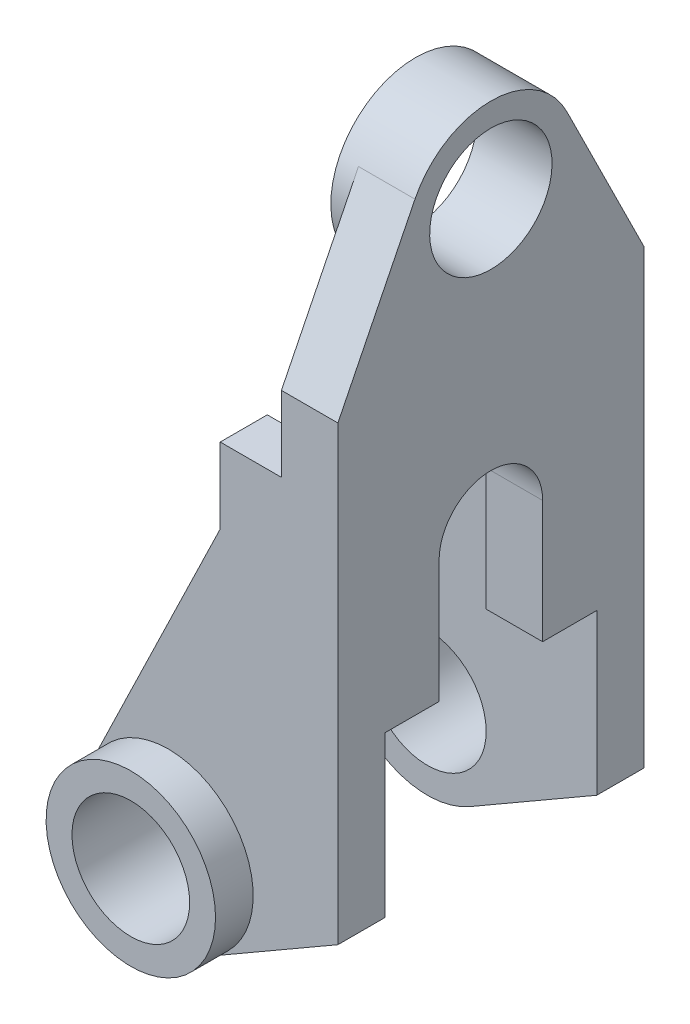
from build123d import *

# Parameters (mm, degrees)
BOSS_EXTRUDE1_DEPTH = 5
BOSS_EXTRUDE2_START = 8
SKETCH2_R           = 12.5
BOSS_EXTRUDE2_DEPTH = 8
CUT_EXTRUDE1_REACH  = 91.615
SKETCH3_R           = 12.5
SKETCH5_R           = 13
BOSS_EXTRUDE3_DEPTH = 12
SKETCH6_R           = 18
SKETCH6_R_2         = 13
BOSS_EXTRUDE4_DEPTH = 16
CUT_EXTRUDE2_REACH  = 160.918
SKETCH7_R           = 12.5
BOSS_EXTRUDE5_DEPTH = 12


with BuildPart() as part:
    # Sketch1 → Boss-Extrude1 (new, symmetric)
    with BuildSketch(Plane.XY):
        with BuildLine():
            Line((27.199616854, 56.153190853), (27.199616854, 72.153190853))
            Line((27.199616854, 72.153190853), (52.199616854, 72.153190853))
            Line((52.199616854, 72.153190853), (52.199616854, -7.846809147))
            Line((52.199616854, -7.846809147), (25.199616854, -23.435266415))
            ThreePointArc((25.199616854, -23.435266415), (3.94149511, -21.027797399), (0, 0))
            Line((0, 0), (27.199616854, 56.153190853))
        make_face()
    boss_extrude1 = extrude(amount=BOSS_EXTRUDE1_DEPTH, both=True)

    # Sketch2 → Boss-Extrude2 (add)
    with BuildSketch(Plane.XY.offset(5).offset(BOSS_EXTRUDE2_START)):
        with BuildLine():
            ThreePointArc((34.199616854, -7.846809147), (20.224967561, 9.697322399), (0, 0))
            ThreePointArc((0, 0), (3.94149511, -21.027797399), (25.199616854, -23.435266415))
            ThreePointArc((25.199616854, -23.435266415), (31.788074122, -16.846809147), (34.199616854, -7.846809147))
        make_face()
        with Locations((16.199616854, -7.846809147)):
            Circle(SKETCH2_R, mode=Mode.SUBTRACT)
    boss_extrude2 = extrude(amount=-BOSS_EXTRUDE2_DEPTH)

    # Sketch3 → Cut-Extrude1 (cut, up to next)
    with BuildSketch(Plane.XY.offset(5), mode=Mode.PRIVATE) as cut_extrude1_sk1:
        with Locations(Location((16.199616854, -7.846809147, 0), (0, 0, 180))):
            Circle(SKETCH3_R)
    cut_extrude1_tool1 = extrude(cut_extrude1_sk1.sketch, amount=-CUT_EXTRUDE1_REACH, mode=Mode.PRIVATE) & part.part
    add(cut_extrude1_tool1.solids().sort_by_distance((16.199617, -7.846809, 5))[0], mode=Mode.SUBTRACT)

    # Sketch5 → Boss-Extrude3 (add)
    with BuildSketch(Plane(origin=(52.199616854, 0, 0), x_dir=(0, 0, -1), z_dir=(1, 0, 0))):
        with BuildLine():
            Line((11.376048584, 121.154327694), (-5, 88.153190853))
            Line((-5, 88.153190853), (-5, 72.153190853))
            Line((-5, 72.153190853), (60, 72.153190853))
            Line((60, 72.153190853), (60, 88.153190853))
            Line((60, 88.153190853), (43.623951416, 121.154327694))
            ThreePointArc((43.623951416, 121.154327694), (27.5, 131.153190853), (11.376048584, 121.154327694))
        make_face()
        with Locations(Location((27.5, 113.153190853, 0), (0, 0, 90))):
            Circle(SKETCH5_R, mode=Mode.SUBTRACT)
    extrude(amount=-BOSS_EXTRUDE3_DEPTH)

    # Sketch6 → Boss-Extrude4 (add)
    with BuildSketch(Plane(origin=(52.199616854, 0, 0), x_dir=(0, 0, -1), z_dir=(1, 0, 0))):
        with Locations(Location((27.5, 113.153190853, 0), (0, 0, 90))):
            Circle(SKETCH6_R)
        with Locations(Location((27.5, 113.153190853, 0), (0, 0, 90))):
            Circle(SKETCH6_R_2, mode=Mode.SUBTRACT)
    extrude(amount=-BOSS_EXTRUDE4_DEPTH)

    # Mirror1: Boss-Extrude1, Boss-Extrude2 across plane
    add(boss_extrude1.mirror(Plane.XY.offset(-27.5)))
    add(boss_extrude2.mirror(Plane.XY.offset(-27.5)))

    # Sketch7 → Cut-Extrude2 (cut, up to next)
    with BuildSketch(Plane(origin=(0, 0, -60), x_dir=(-1, 0, 0), z_dir=(0, 0, -1)), mode=Mode.PRIVATE) as cut_extrude2_sk1:
        with Locations((-16.199616854, -7.846809147)):
            Circle(SKETCH7_R)
    cut_extrude2_tool1 = extrude(cut_extrude2_sk1.sketch, amount=-CUT_EXTRUDE2_REACH, mode=Mode.PRIVATE) & part.part
    add(cut_extrude2_tool1.solids().sort_by_distance((16.199617, -7.846809, -60))[0], mode=Mode.SUBTRACT)

    # Sketch8 → Boss-Extrude5 (add)
    with BuildSketch(Plane.ZY.offset(-40.199616854)):
        with BuildLine():
            Line((-5, 26.153190853), (-16.5, 26.153190853))
            Line((-16.5, 26.153190853), (-16.5, 52.153190853))
            ThreePointArc((-16.5, 52.153190853), (-27.5, 63.153190853), (-38.5, 52.153190853))
            Line((-38.5, 52.153190853), (-38.5, 26.153190853))
            Line((-38.5, 26.153190853), (-50, 26.153190853))
            Line((-50, 26.153190853), (-50, 72.153190853))
            Line((-50, 72.153190853), (-5, 72.153190853))
            Line((-5, 72.153190853), (-5, 26.153190853))
        make_face()
    extrude(amount=-BOSS_EXTRUDE5_DEPTH)


solid = part.part
